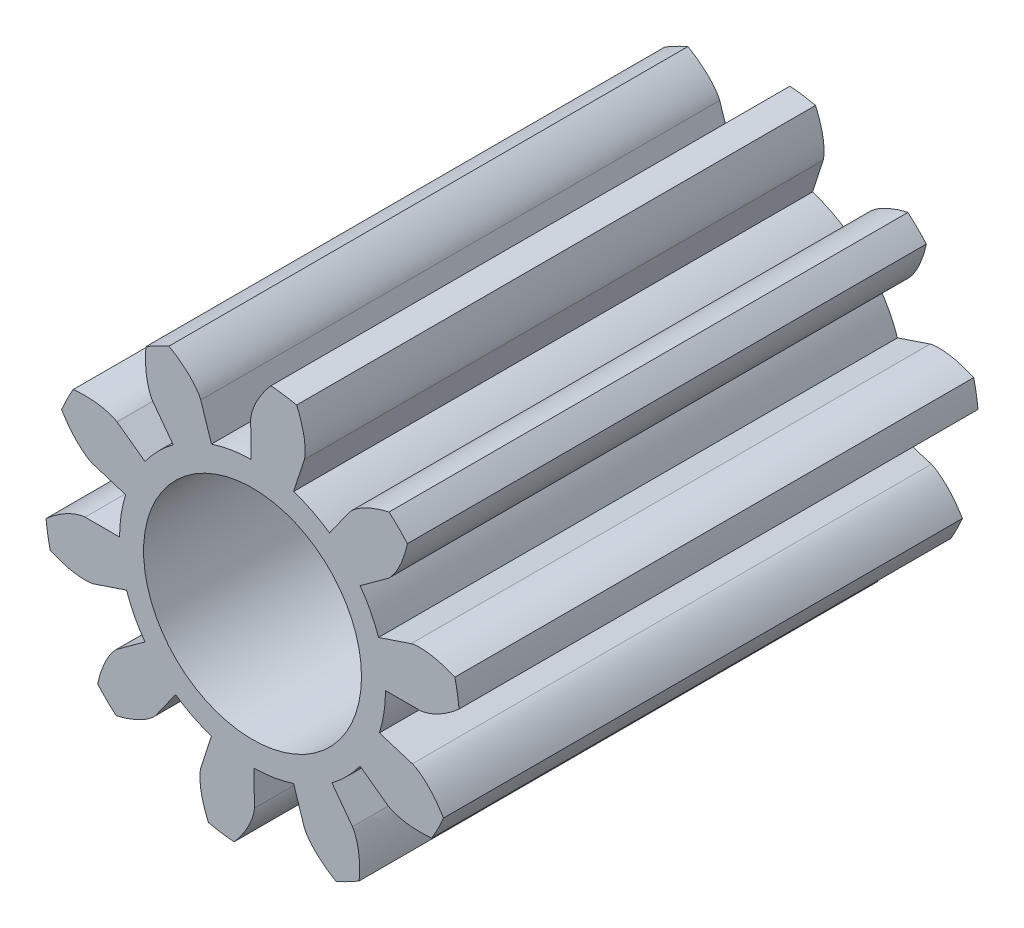
from build123d import *

# Parameters (mm, degrees)
BOSS_EXTRUDE3_DEPTH     = 9.525
CIRPATTERN8_COUNT       = 10
SKETCH1_7_R             = 4.88061
BOSS_EXTRUDE4_DEPTH     = 9.525
CUT_EXTRUDE1_DEPTH      = 15.346185424
CUT_EXTRUDE1_DEPTH_BACK = 15.346185424
SKETCH6_R               = 4


with BuildPart() as part:
    # Sketch1 → Boss-Extrude3 (new, symmetric)
    with BuildSketch(Plane.XY):
        with BuildLine():
            Line((4.88061, 0), (6.147737516, 0))
            add(Edge.make_bspline(
                [(6.147737516, 0), (6.152282558, 9.6181e-05), (6.165020355, 0.000663591), (6.189048581, 0.002911117), (6.228094683, 0.008241241), (6.277543837, 0.017466697), (6.340989584, 0.032167424), (6.415016957, 0.053030531), (6.495480931, 0.079638817), (6.581917638, 0.112513164), (6.667063631, 0.148745953), (6.750887612, 0.188045954), (6.833319836, 0.230017367), (6.931802383, 0.284140105), (7.047919233, 0.353574443), (7.180493805, 0.441182383), (7.326925959, 0.548043667), (7.446236604, 0.644260382), (7.526652362, 0.713262698), (7.57147535, 0.753217398), (7.581757728, 0.762462956)],
                knots=[0, 0, 0, 0, 0, 0.005376748, 0.015083688, 0.02853182, 0.046610139, 0.064854849, 0.092110525, 0.119476175, 0.146842495, 0.174208853, 0.201574955, 0.228941013, 0.256307345, 0.307035032, 0.361767351, 0.41649966, 0.471231936, 0.487590398, 0.487590398, 0.487590398, 0.487590398, 0.487590398], degree=4))
            ThreePointArc((7.581757728, 0.762462956), (7.554282446, 0.998607392), (7.51945393, 1.233779798))
            Line((7.51945393, 1.233779798), (4.816210242, 0.790235961))
            ThreePointArc((4.816210242, 0.790235961), (4.864483418, 0.396427863), (4.88061, 0))
        make_face()
    boss_extrude3 = extrude(amount=BOSS_EXTRUDE3_DEPTH, both=True)

    # Mirror2: Boss-Extrude3 across plane
    add(boss_extrude3.mirror(Plane(origin=(0, 0, 9.525), x_dir=(0, 0, 1), z_dir=(0.16191335930529954, -0.9868049777329222, 0))))


with BuildPart() as cirpattern8_1:
    # CirPattern8: pattern copy
    add(part.part.rotate(Axis((0, 0, -1.27), (0, 0, 1)), 1 * 360 / CIRPATTERN8_COUNT))


with BuildPart() as cirpattern8_2:
    # CirPattern8: pattern copy
    add(part.part.rotate(Axis((0, 0, -1.27), (0, 0, 1)), 2 * 360 / CIRPATTERN8_COUNT))


with BuildPart() as cirpattern8_3:
    # CirPattern8: pattern copy
    add(part.part.rotate(Axis((0, 0, -1.27), (0, 0, 1)), 3 * 360 / CIRPATTERN8_COUNT))


with BuildPart() as cirpattern8_4:
    # CirPattern8: pattern copy
    add(part.part.rotate(Axis((0, 0, -1.27), (0, 0, 1)), 4 * 360 / CIRPATTERN8_COUNT))


with BuildPart() as cirpattern8_5:
    # CirPattern8: pattern copy
    add(part.part.rotate(Axis((0, 0, -1.27), (0, 0, 1)), 5 * 360 / CIRPATTERN8_COUNT))


with BuildPart() as cirpattern8_6:
    # CirPattern8: pattern copy
    add(part.part.rotate(Axis((0, 0, -1.27), (0, 0, 1)), 6 * 360 / CIRPATTERN8_COUNT))


with BuildPart() as cirpattern8_7:
    # CirPattern8: pattern copy
    add(part.part.rotate(Axis((0, 0, -1.27), (0, 0, 1)), 7 * 360 / CIRPATTERN8_COUNT))


with BuildPart() as cirpattern8_8:
    # CirPattern8: pattern copy
    add(part.part.rotate(Axis((0, 0, -1.27), (0, 0, 1)), 8 * 360 / CIRPATTERN8_COUNT))


with BuildPart() as cirpattern8_9:
    # CirPattern8: pattern copy
    add(part.part.rotate(Axis((0, 0, -1.27), (0, 0, 1)), 9 * 360 / CIRPATTERN8_COUNT))


with BuildPart() as part_1:
    add(part.part)

    add(cirpattern8_1.part)  # Boss-Extrude4 merges CirPattern8_1

    add(cirpattern8_2.part)  # Boss-Extrude4 merges CirPattern8_2

    add(cirpattern8_3.part)  # Boss-Extrude4 merges CirPattern8_3

    add(cirpattern8_4.part)  # Boss-Extrude4 merges CirPattern8_4

    add(cirpattern8_5.part)  # Boss-Extrude4 merges CirPattern8_5

    add(cirpattern8_6.part)  # Boss-Extrude4 merges CirPattern8_6

    add(cirpattern8_7.part)  # Boss-Extrude4 merges CirPattern8_7

    add(cirpattern8_8.part)  # Boss-Extrude4 merges CirPattern8_8

    add(cirpattern8_9.part)  # Boss-Extrude4 merges CirPattern8_9
    # Sketch1<7> → Boss-Extrude4 (add, symmetric)
    with BuildSketch(Plane.XY):
        Circle(SKETCH1_7_R)
    extrude(amount=BOSS_EXTRUDE4_DEPTH, both=True)

    # Sketch6 → Cut-Extrude1 (cut, two sides: drawn at the far end of the back side and taken through both)
    with BuildSketch(Plane.XY.offset(-CUT_EXTRUDE1_DEPTH_BACK)):
        Circle(SKETCH6_R)
    extrude(amount=CUT_EXTRUDE1_DEPTH + CUT_EXTRUDE1_DEPTH_BACK, mode=Mode.SUBTRACT)


solid = part_1.part
